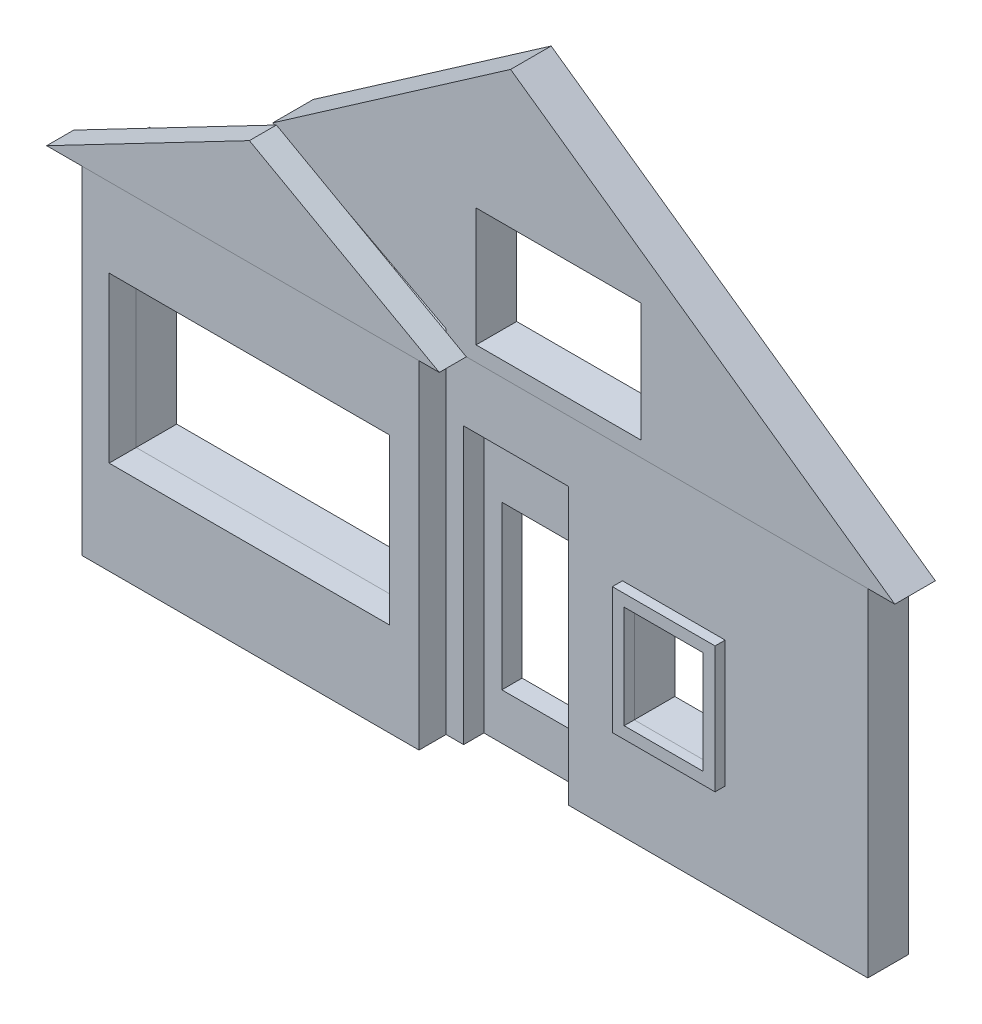
from build123d import *

# Parameters (mm, degrees)
WALLSKETCH_W                                   = 224.5
WALLSKETCH_H                                   = 99.8
MAINWALL_DEPTH                                 = 6
WINDOWSKETCH_W                                 = 23.4
WINDOWSKETCH_H                                 = 30.4
WINDOWCUT_DEPTH                                = 12.2
PILOT001_ENTRANCERECESS_PROVISIONAL_START      = 6
PILOT001_ENTRANCERECESSSKETCH_W                = 31
PILOT001_ENTRANCERECESSSKETCH_H                = 81.7
PILOT001_ENTRANCERECESS_PROVISIONAL_DEPTH      = 6
PILOT001_DOOROPENINGSKETCH_W                   = 20.9
PILOT001_DOOROPENINGSKETCH_H                   = 48.1
PILOT001_DOOROPENING_PROVISIONAL_DEPTH         = 6.2
PILOT001_LARGEWINDOWOPENING_PROVISIONAL_START  = 6
PILOT001_LARGEWINDOWOPENINGSKETCH_W            = 82.9
PILOT001_LARGEWINDOWOPENINGSKETCH_H            = 48.7
PILOT001_LARGEWINDOWOPENING_PROVISIONAL_DEPTH  = 12.2
PILOT001_LEFTBAYBASE_PROVISIONAL_START         = 6
PILOT001_LEFTBAYBASESKETCH_W                   = 99.7
PILOT001_LEFTBAYBASESKETCH_H                   = 27.7
PILOT001_LEFTBAYBASE_PROVISIONAL_DEPTH         = 8
PILOT001_LEFTBAYUPPERSUPPORT_PROVISIONAL_START = 6
PILOT001_LEFTBAYUPPERSUPPORT_PROVISIONAL_DEPTH = 8
PILOT001_MAINGABLEPROFILE_PROVISIONAL_START    = 6
PILOT001_MAINGABLEPROFILE_PROVISIONAL_DEPTH    = 12
PILOT001_LEFTGABLEPROFILE_PROVISIONAL_START    = 6
PILOT001_LEFTGABLEPROFILE_PROVISIONAL_DEPTH    = 8
PILOT001_UPPERGABLEWINDOWOPENING_PROVISI_START = 6
PILOT001_UPPERGABLEWINDOWOPENINGSKETCH_W       = 48.8
PILOT001_UPPERGABLEWINDOWOPENINGSKETCH_H       = 35.1
PILOT001_UPPERGABLEWINDOWOPENING_PROVISI_DEPTH = 12.2
PILOT001_OPENINGSURROUND_PROVISIONAL_START     = 6
PILOT001_OPENINGSURROUNDSKETCH_W               = 30.4
PILOT001_OPENINGSURROUNDSKETCH_H               = 37.4
PILOT001_OPENINGSURROUNDSKETCH_W_2             = 23.4
PILOT001_OPENINGSURROUNDSKETCH_H_2             = 30.4
PILOT001_OPENINGSURROUND_PROVISIONAL_DEPTH     = 3


with BuildPart() as part:
    # WallSketch → MainWall (new, symmetric)
    with BuildSketch(Plane.XY):
        Rectangle(WALLSKETCH_W, WALLSKETCH_H)
    extrude(amount=MAINWALL_DEPTH, both=True)

    # WindowSketch → WindowCut (cut)
    with BuildSketch(Plane.XY.offset(6)):
        with Locations((54.85, -3.1)):
            Rectangle(WINDOWSKETCH_W, WINDOWSKETCH_H)
    extrude(amount=-WINDOWCUT_DEPTH, mode=Mode.SUBTRACT)

    # Pilot001_EntranceRecessSketch → Pilot001_EntranceRecess_PROVISIONAL (cut)
    with BuildSketch(Plane.XY.offset(PILOT001_ENTRANCERECESS_PROVISIONAL_START)):
        with Locations((8.15, -9.05)):
            Rectangle(PILOT001_ENTRANCERECESSSKETCH_W, PILOT001_ENTRANCERECESSSKETCH_H)
    extrude(amount=-PILOT001_ENTRANCERECESS_PROVISIONAL_DEPTH, mode=Mode.SUBTRACT)

    # Pilot001_DoorOpeningSketch → Pilot001_DoorOpening_PROVISIONAL (cut)
    with BuildSketch(Plane.XY):
        with Locations((8.4, -12.15)):
            Rectangle(PILOT001_DOOROPENINGSKETCH_W, PILOT001_DOOROPENINGSKETCH_H)
    extrude(amount=-PILOT001_DOOROPENING_PROVISIONAL_DEPTH, mode=Mode.SUBTRACT)

    # Pilot001_LargeWindowOpeningSketch → Pilot001_LargeWindowOpening_PROVISIONAL (cut)
    with BuildSketch(Plane.XY.offset(PILOT001_LARGEWINDOWOPENING_PROVISIONAL_START)):
        with Locations((-62.8, 2.15)):
            Rectangle(PILOT001_LARGEWINDOWOPENINGSKETCH_W, PILOT001_LARGEWINDOWOPENINGSKETCH_H)
    extrude(amount=-PILOT001_LARGEWINDOWOPENING_PROVISIONAL_DEPTH, mode=Mode.SUBTRACT)


with BuildPart() as body_2:
    # Pilot001_LeftBayBaseSketch → Pilot001_LeftBayBase_PROVISIONAL (new body)
    with BuildSketch(Plane.XY.offset(PILOT001_LEFTBAYBASE_PROVISIONAL_START)):
        with Locations((-62.4, -36.05)):
            Rectangle(PILOT001_LEFTBAYBASESKETCH_W, PILOT001_LEFTBAYBASESKETCH_H)
    extrude(amount=PILOT001_LEFTBAYBASE_PROVISIONAL_DEPTH)

    # Pilot001_LeftBayUpperSupportSketch → Pilot001_LeftBayUpperSupport_PROVISIONAL (add)
    with BuildSketch(Plane.XY.offset(PILOT001_LEFTBAYUPPERSUPPORT_PROVISIONAL_START)):
        Polygon((-112.25, -22.2), (-104.25, -22.2), (-104.25, 26.5), (-21.35, 26.5), (-21.35, -22.2), (-12.55, -22.2), (-12.55, 49.9), (-112.25, 49.9), align=None)
    extrude(amount=PILOT001_LEFTBAYUPPERSUPPORT_PROVISIONAL_DEPTH)


with BuildPart() as body_3:
    # Pilot001_MainGableProfileSketch → Pilot001_MainGableProfile_PROVISIONAL (new body)
    with BuildSketch(Plane.XY.offset(PILOT001_MAINGABLEPROFILE_PROVISIONAL_START)):
        Polygon((-12.55, 49.9), (120.25, 49.9), (6.55, 130.1), (-63.85, 81.2), (-12.55, 54.1), align=None)
    extrude(amount=-PILOT001_MAINGABLEPROFILE_PROVISIONAL_DEPTH)

    # Pilot001_UpperGableWindowOpeningSketch → Pilot001_UpperGableWindowOpening_PROVISIONAL (cut)
    with BuildSketch(Plane.XY.offset(PILOT001_UPPERGABLEWINDOWOPENING_PROVISI_START)):
        with Locations((20.75, 71.95)):
            Rectangle(PILOT001_UPPERGABLEWINDOWOPENINGSKETCH_W, PILOT001_UPPERGABLEWINDOWOPENINGSKETCH_H)
    extrude(amount=-PILOT001_UPPERGABLEWINDOWOPENING_PROVISI_DEPTH, mode=Mode.SUBTRACT)


with BuildPart() as body_4:
    # Pilot001_LeftGableProfileSketch → Pilot001_LeftGableProfile_PROVISIONAL (new body)
    with BuildSketch(Plane.XY.offset(PILOT001_LEFTGABLEPROFILE_PROVISIONAL_START)):
        Polygon((-122.75, 49.9), (-6.55, 49.9), (-62.75, 81.2), align=None)
    extrude(amount=PILOT001_LEFTGABLEPROFILE_PROVISIONAL_DEPTH)


with BuildPart() as body_5:
    # Pilot001_OpeningSurroundSketch → Pilot001_OpeningSurround_PROVISIONAL (new body)
    with BuildSketch(Plane.XY.offset(PILOT001_OPENINGSURROUND_PROVISIONAL_START)):
        with Locations((54.85, -3.1)):
            Rectangle(PILOT001_OPENINGSURROUNDSKETCH_W, PILOT001_OPENINGSURROUNDSKETCH_H)
        with Locations((54.85, -3.1)):
            Rectangle(PILOT001_OPENINGSURROUNDSKETCH_W_2, PILOT001_OPENINGSURROUNDSKETCH_H_2, mode=Mode.SUBTRACT)
    extrude(amount=PILOT001_OPENINGSURROUND_PROVISIONAL_DEPTH)


solid = Compound([part.part, body_2.part, body_3.part, body_4.part, body_5.part])
